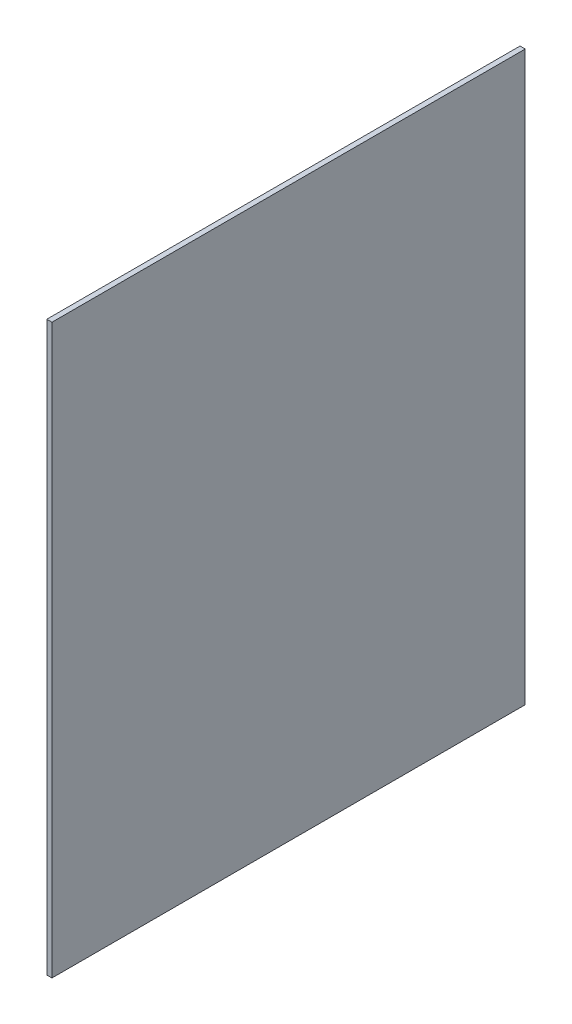
from build123d import *

# Parameters (mm, degrees)
SZKIC3_W                    = 275
SZKIC3_H                    = 330
DODANIE_WYCI_GNI_CIE1_DEPTH = 3


with BuildPart() as part:
    # Szkic3 → Dodanie-wyciągnięcie1 (new body)
    with BuildSketch(Plane(origin=(0, 0, 0), x_dir=(0, 0, -1), z_dir=(1, 0, 0))):
        with Locations((137.5, 165)):
            Rectangle(SZKIC3_W, SZKIC3_H)
    extrude(amount=DODANIE_WYCI_GNI_CIE1_DEPTH)


solid = part.part
